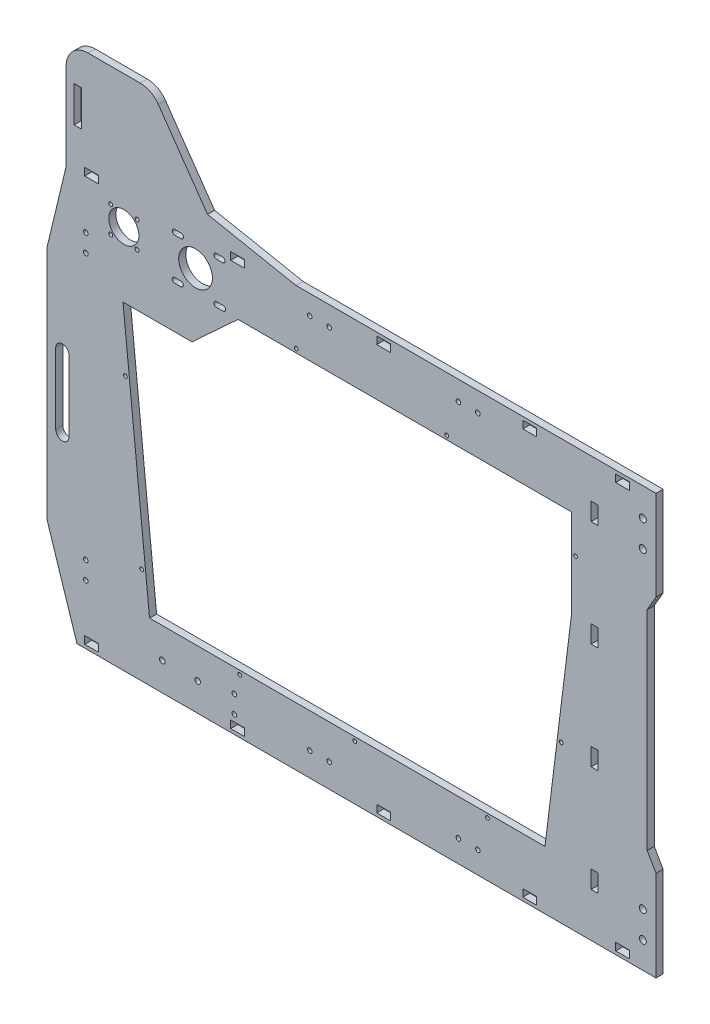
from build123d import *

# Parameters (mm, degrees)
ESQUISSE1_W              = 15.5
ESQUISSE1_H              = 8.5
ESQUISSE1_W_2            = 8
ESQUISSE1_H_2            = 20
ESQUISSE1_W_3            = 512.843253
ESQUISSE1_H_3            = 342.3
BOSS_EXTRU_1_DEPTH       = 8
ESQUISSE2_R              = 19.05
ENL_V_MAT_EXTRU_1_DEPTH  = 10
ESQUISSE4_R              = 2.8
ENL_V_MAT_EXTRU_2_DEPTH  = 10
ESQUISSE5_R              = 3.15
ENL_V_MAT_EXTRU_3_DEPTH  = 10
ESQUISSE6_R              = 2.65
ENL_V_MAT_EXTRU_4_DEPTH  = 10
BOSS_EXTRU_2_DEPTH       = 8
ENL_V_MAT_EXTRU_6_DEPTH  = 10
ESQUISSE10_W             = 8.5
ESQUISSE10_H             = 40.5
ENL_V_MAT_EXTRU_7_DEPTH  = 10
ESQUISSE11_R             = 2.6
ENL_V_MAT_EXTRU_8_DEPTH  = 10
ESQUISSE12_R             = 4
ENL_V_MAT_EXTRU_9_DEPTH  = 10
ENL_V_MAT_EXTRU_10_DEPTH = 10
ESQUISSE14_R             = 2.149999999
ENL_V_MAT_EXTRU_11_DEPTH = 30
ESQUISSE15_R             = 2.6
ENL_V_MAT_EXTRU_12_DEPTH = 8
ESQUISSE16_R             = 2.6
ENL_V_MAT_EXTRU_13_DEPTH = 11


with BuildPart() as part:
    # Esquisse1 → Boss.-Extru.1 (new body)
    with BuildSketch(Plane.XY):
        with BuildLine():
            Line((601.343253, 40), (194.509615385, 40))
            Line((194.509615385, 40), (94.509615385, 59.554373535))
            Line((94.509615385, 59.554373535), (38.991835768, 139.285714286))
            ThreePointArc((38.991835768, 139.285714286), (30.048291849, 147.160131511), (18.475540602, 150))
            Line((18.475540602, 150), (-40.245192308, 150))
            ThreePointArc((-40.245192308, 150), (-57.922861837, 142.67766953), (-65.245192308, 125))
            Line((-65.245192308, 125), (-65.245192308, 26.5))
            Line((-65.245192308, 26.5), (-87, -64))
            Line((-87, -64), (-87, -329.3))
            Line((-87, -329.3), (-53, -434.3))
            Line((-53, -434.3), (601.343253, -434.3))
            Line((601.343253, -434.3), (601.343253, -331.846883663))
            Line((601.343253, -331.846883663), (591.343253, -314.526375587))
            Line((591.343253, -314.526375587), (591.343253, -78.820508076))
            Line((591.343253, -78.820508076), (601.343253, -61.5))
            Line((601.343253, -61.5), (601.343253, 40))
        make_face()
        with Locations((-36.5, -426.3)):
            Rectangle(ESQUISSE1_W, ESQUISSE1_H, mode=Mode.SUBTRACT)
        with Locations((293.5, -426.3)):
            Rectangle(ESQUISSE1_W, ESQUISSE1_H, mode=Mode.SUBTRACT)
        with Locations((458.5, -426.3)):
            Rectangle(ESQUISSE1_W, ESQUISSE1_H, mode=Mode.SUBTRACT)
        with Locations((128.5, -426.3)):
            Rectangle(ESQUISSE1_W, ESQUISSE1_H, mode=Mode.SUBTRACT)
        with Locations((563.5, -426.3)):
            Rectangle(ESQUISSE1_W, ESQUISSE1_H, mode=Mode.SUBTRACT)
        with Locations((532, -374.3)):
            Rectangle(ESQUISSE1_W_2, ESQUISSE1_H_2, mode=Mode.SUBTRACT)
        with Locations((532, -254.3)):
            Rectangle(ESQUISSE1_W_2, ESQUISSE1_H_2, mode=Mode.SUBTRACT)
        with Locations((532, -134.3)):
            Rectangle(ESQUISSE1_W_2, ESQUISSE1_H_2, mode=Mode.SUBTRACT)
        with Locations((563.5, 32)):
            Rectangle(ESQUISSE1_W, ESQUISSE1_H, mode=Mode.SUBTRACT)
        with Locations((458.5, 32)):
            Rectangle(ESQUISSE1_W, ESQUISSE1_H, mode=Mode.SUBTRACT)
        with Locations((293.5, 32)):
            Rectangle(ESQUISSE1_W, ESQUISSE1_H, mode=Mode.SUBTRACT)
        with Locations((128.5, 32)):
            Rectangle(ESQUISSE1_W, ESQUISSE1_H, mode=Mode.SUBTRACT)
        with Locations((-36.5, 32)):
            Rectangle(ESQUISSE1_W, ESQUISSE1_H, mode=Mode.SUBTRACT)
        with Locations((532, -14.3)):
            Rectangle(ESQUISSE1_W_2, ESQUISSE1_H_2, mode=Mode.SUBTRACT)
        with Locations((249.4216265, -197.15)):
            Rectangle(ESQUISSE1_W_3, ESQUISSE1_H_3, mode=Mode.SUBTRACT)
        with BuildLine():
            ThreePointArc((-12.599242405, 14.849242405), (-14.849242405, 17.099242405), (-17.099242405, 14.849242405))
            ThreePointArc((-17.099242405, 14.849242405), (-14.849242405, 12.599242405), (-12.599242405, 14.849242405))
        make_face(mode=Mode.SUBTRACT)
        with BuildLine():
            ThreePointArc((-17, 0), (0, -17), (17, 0))
            ThreePointArc((17, 0), (0, 17), (-17, 0))
        make_face(mode=Mode.SUBTRACT)
        with BuildLine():
            ThreePointArc((17.099242405, 14.849242405), (14.849242405, 17.099242405), (12.599242405, 14.849242405))
            ThreePointArc((12.599242405, 14.849242405), (14.849242405, 12.599242405), (17.099242405, 14.849242405))
        make_face(mode=Mode.SUBTRACT)
        with BuildLine():
            ThreePointArc((17.099242405, -14.849242405), (14.849242405, -12.599242405), (12.599242405, -14.849242405))
            ThreePointArc((12.599242405, -14.849242405), (14.849242405, -17.099242405), (17.099242405, -14.849242405))
        make_face(mode=Mode.SUBTRACT)
        with BuildLine():
            ThreePointArc((-12.599242405, -14.849242405), (-14.849242405, -12.599242405), (-17.099242405, -14.849242405))
            ThreePointArc((-17.099242405, -14.849242405), (-14.849242405, -17.099242405), (-12.599242405, -14.849242405))
        make_face(mode=Mode.SUBTRACT)
    extrude(amount=BOSS_EXTRU_1_DEPTH)

    # Esquisse2 → Enlèv. mat.-Extru.1 (cut)
    with BuildSketch(Plane.XY.offset(8)):
        with Locations((81, 0)):
            Circle(ESQUISSE2_R)
    extrude(amount=-ENL_V_MAT_EXTRU_1_DEPTH, mode=Mode.SUBTRACT)

    # Esquisse4 → Enlèv. mat.-Extru.2 (cut)
    with BuildSketch(Plane.XY.offset(8)):
        with Locations((57.45, 23.55)):
            Circle(ESQUISSE4_R)
        with Locations((104.55, 23.55)):
            Circle(ESQUISSE4_R)
        with Locations((104.55, -23.55)):
            Circle(ESQUISSE4_R)
        with Locations((57.45, -23.55)):
            Circle(ESQUISSE4_R)
    extrude(amount=-ENL_V_MAT_EXTRU_2_DEPTH, mode=Mode.SUBTRACT)

    # Esquisse5 → Enlèv. mat.-Extru.3 (cut)
    with BuildSketch(Plane.XY.offset(8)):
        with Locations((83.4, -402.5)):
            Circle(ESQUISSE5_R)
        with Locations((43.4, -402.5)):
            Circle(ESQUISSE5_R)
    extrude(amount=-ENL_V_MAT_EXTRU_3_DEPTH, mode=Mode.SUBTRACT)

    # Esquisse6 → Enlèv. mat.-Extru.4 (cut)
    with BuildSketch(Plane.XY.offset(8)):
        with Locations((124.840000002, -414.438608855)):
            Circle(ESQUISSE6_R)
        with Locations((124.840000002, -394.438608855)):
            Circle(ESQUISSE6_R)
    extrude(amount=-ENL_V_MAT_EXTRU_4_DEPTH, mode=Mode.SUBTRACT)

    # Esquisse8 → Boss.-Extru.2 (add)
    with BuildSketch(Plane.XY.offset(8)):
        Polygon((-7, -26), (-7, -368.3), (29.000000002, -368.300000002), (-0.999999998, -74.000000002), (77.000000002, -74.000000002), (129.000000002, -26.000000002), align=None)
        Polygon((505.843253002, -126.000000002), (475.843253002, -368.300000002), (505.843253, -368.3), align=None)
    extrude(amount=-BOSS_EXTRU_2_DEPTH)

    # Esquisse9 → Enlèv. mat.-Extru.6 (cut)
    with BuildSketch(Plane.XY.offset(8)):
        with BuildLine():
            Line((-61.999999998, -156.650000002), (-61.999999998, -236.650000002))
            ThreePointArc((-61.999999998, -236.650000002), (-69.499999998, -244.150000002), (-76.999999998, -236.650000002))
            Line((-76.999999998, -236.650000002), (-76.999999998, -156.650000002))
            ThreePointArc((-76.999999998, -156.650000002), (-69.499999998, -149.150000002), (-61.999999998, -156.650000002))
        make_face()
    extrude(amount=-ENL_V_MAT_EXTRU_6_DEPTH, mode=Mode.SUBTRACT)

    # Esquisse10 → Enlèv. mat.-Extru.7 (cut)
    with BuildSketch(Plane.XY.offset(8)):
        with Locations((-51.999999998, 91.999999998)):
            Rectangle(ESQUISSE10_W, ESQUISSE10_H)
    extrude(amount=-ENL_V_MAT_EXTRU_7_DEPTH, mode=Mode.SUBTRACT)

    # Esquisse11 → Enlèv. mat.-Extru.8 (cut)
    with BuildSketch(Plane.XY.offset(8)):
        with Locations((378, 18)):
            Circle(ESQUISSE11_R)
        with Locations((400, 18)):
            Circle(ESQUISSE11_R)
        with Locations((378.000000002, -409.438608855)):
            Circle(ESQUISSE11_R)
        with Locations((400.000000002, -409.438608855)):
            Circle(ESQUISSE11_R)
    extrude(amount=-ENL_V_MAT_EXTRU_8_DEPTH, mode=Mode.SUBTRACT)

    # Esquisse12 → Enlèv. mat.-Extru.9 (cut)
    with BuildSketch(Plane.XY.offset(8)):
        with Locations((586.343253, -404.438608855)):
            Circle(ESQUISSE12_R)
        with Locations((586.343253, -374.438608855)):
            Circle(ESQUISSE12_R)
        with Locations((586.343253, -22)):
            Circle(ESQUISSE12_R)
        with Locations((586.343253, 8)):
            Circle(ESQUISSE12_R)
    extrude(amount=-ENL_V_MAT_EXTRU_9_DEPTH, mode=Mode.SUBTRACT)

    # Esquisse13 → Enlèv. mat.-Extru.10 (cut)
    with BuildSketch(Plane.XY.offset(8)):
        with BuildLine():
            Line((57.45, 26.35), (64.45, 26.35))
            ThreePointArc((64.45, 26.35), (67.25, 23.55), (64.45, 20.75))
            Line((64.45, 20.75), (57.45, 20.75))
            ThreePointArc((57.45, 20.75), (54.65, 23.55), (57.45, 26.35))
        make_face()
        with BuildLine():
            Line((104.55, 26.35), (111.55, 26.35))
            ThreePointArc((111.55, 26.35), (114.35, 23.55), (111.55, 20.75))
            Line((111.55, 20.75), (104.55, 20.75))
            ThreePointArc((104.55, 20.75), (101.75, 23.55), (104.55, 26.35))
        make_face()
        with BuildLine():
            Line((104.55, -20.75), (112.249014823, -20.75))
            ThreePointArc((112.249014823, -20.75), (115.049014823, -23.55), (112.249014823, -26.35))
            Line((112.249014823, -26.35), (104.55, -26.35))
            ThreePointArc((104.55, -26.35), (101.75, -23.55), (104.55, -20.75))
        make_face()
        with BuildLine():
            Line((57.45, -20.75), (64.45, -20.75))
            ThreePointArc((64.45, -20.75), (67.25, -23.55), (64.45, -26.35))
            Line((64.45, -26.35), (57.45, -26.35))
            ThreePointArc((57.45, -26.35), (54.65, -23.55), (57.45, -20.75))
        make_face()
    extrude(amount=-ENL_V_MAT_EXTRU_10_DEPTH, mode=Mode.SUBTRACT)

    # Esquisse14 → Enlèv. mat.-Extru.11 (cut)
    with BuildSketch(Plane.XY.offset(8)):
        with Locations((130.87079204, -372.800000002)):
            Circle(ESQUISSE14_R)
        with Locations((260.87079204, -372.800000002)):
            Circle(ESQUISSE14_R)
        with Locations((410.87079204, -372.800000002)):
            Circle(ESQUISSE14_R)
        with Locations((494.12090724, -257.300000002)):
            Circle(ESQUISSE14_R)
        with Locations((510.343253002, -67.000000002)):
            Circle(ESQUISSE14_R)
        with Locations((364.843253002, -21.500000002)):
            Circle(ESQUISSE14_R)
        with Locations((194.843253002, -21.500000002)):
            Circle(ESQUISSE14_R)
        with Locations((1.714193166, -145.000000002)):
            Circle(ESQUISSE14_R)
        with Locations((20.06281702, -325.000000002)):
            Circle(ESQUISSE14_R)
    extrude(amount=-ENL_V_MAT_EXTRU_11_DEPTH, mode=Mode.SUBTRACT)

    # Esquisse15 → Enlèv. mat.-Extru.12 (cut)
    with BuildSketch(Plane.XY.offset(8)):
        with Locations((232, 18)):
            Circle(ESQUISSE15_R)
        with Locations((210, 18)):
            Circle(ESQUISSE15_R)
        with Locations((210, -407.300000002)):
            Circle(ESQUISSE15_R)
        with Locations((232, -407.300000002)):
            Circle(ESQUISSE15_R)
    extrude(amount=-ENL_V_MAT_EXTRU_12_DEPTH, mode=Mode.SUBTRACT)

    # Esquisse16 → Enlèv. mat.-Extru.13 (cut)
    with BuildSketch(Plane(origin=(0, 0, 0), x_dir=(-1, 0, 0), z_dir=(0, 0, -1))):
        with Locations((43, -47)):
            Circle(ESQUISSE16_R)
        with Locations((43, -27)):
            Circle(ESQUISSE16_R)
        with Locations((43, -347.3)):
            Circle(ESQUISSE16_R)
        with Locations((43, -367.3)):
            Circle(ESQUISSE16_R)
    extrude(amount=-ENL_V_MAT_EXTRU_13_DEPTH, mode=Mode.SUBTRACT)


solid = part.part
